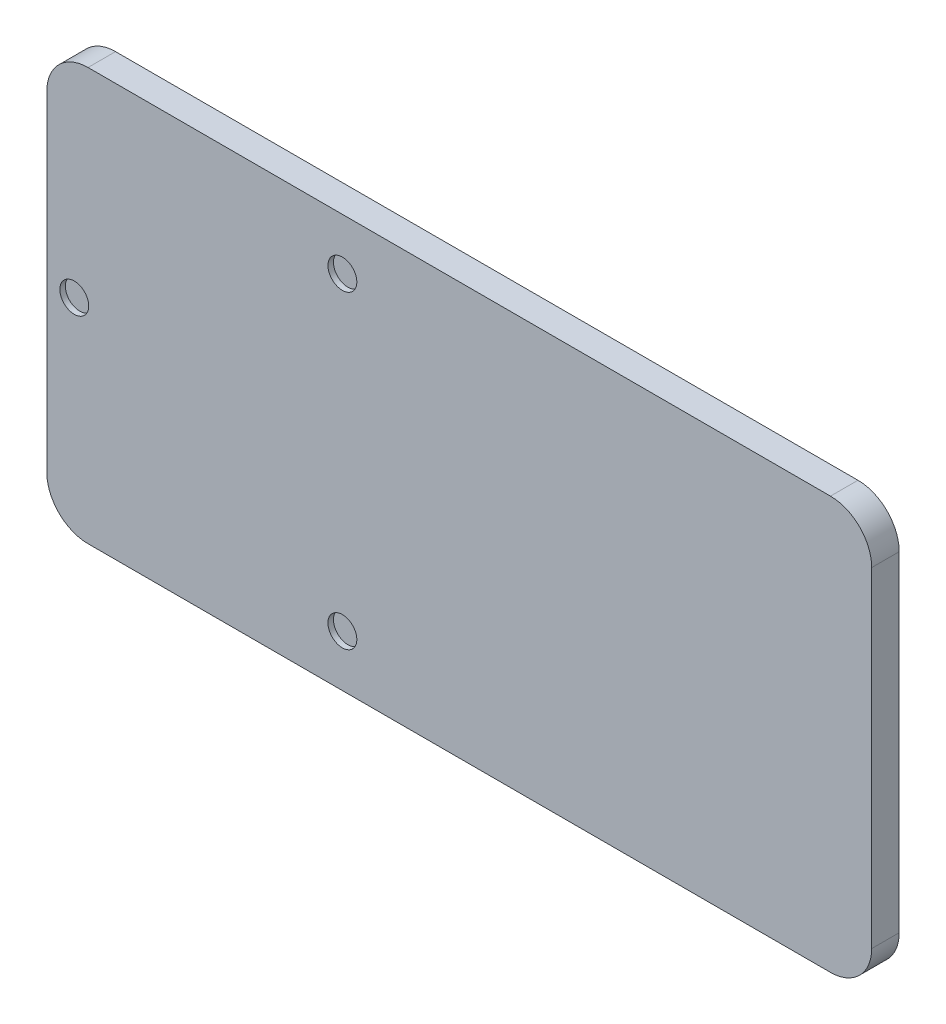
from build123d import *

# Parameters (mm, degrees)
SZKIC1_W                    = 300
SZKIC1_H                    = 150
DODANIE_WYCI_GNI_CIE1_DEPTH = 10
SZKIC2_R                    = 5.25
WYTNIJ_WYCI_GNI_CIE1_DEPTH  = 2
ZAOKR_GLENIE1_R             = 15


with BuildPart() as part:
    # Szkic1 → Dodanie-wyciągnięcie1 (new body)
    with BuildSketch(Plane.XY):
        Rectangle(SZKIC1_W, SZKIC1_H)
    extrude(amount=DODANIE_WYCI_GNI_CIE1_DEPTH)

    # Szkic2 → Wytnij-wyciągnięcie1 (cut)
    with BuildSketch(Plane.XY.offset(10)):
        with Locations((-140, 0)):
            Circle(SZKIC2_R)
        with Locations((-42.5, 56.291651246)):
            Circle(SZKIC2_R)
        with Locations((-42.5, -56.291651246)):
            Circle(SZKIC2_R)
    extrude(amount=-WYTNIJ_WYCI_GNI_CIE1_DEPTH, mode=Mode.SUBTRACT)

    # Zaokrąglenie1
    zaokr_glenie1_edges = [part.edges().sort_by_distance(p)[0] for p in [
        (150, -75, 5),
        (-150, -75, 5),
        (-150, 75, 5),
        (150, 75, 5),
    ]]
    fillet(zaokr_glenie1_edges, radius=ZAOKR_GLENIE1_R)


solid = part.part
